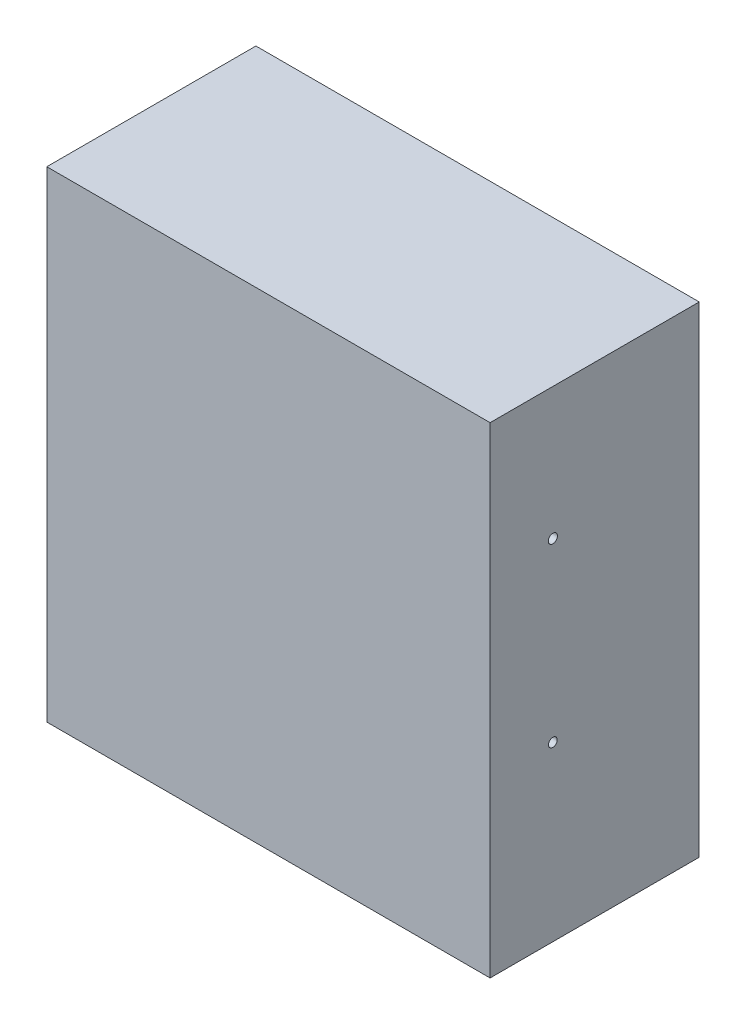
from build123d import *

# Parameters (mm, degrees)
SKETCH_1_W          = 212
SKETCH_1_H          = 230
EXTRUDE_1_DEPTH     = 100
SKETCH_2_W          = 202
SKETCH_2_H          = 90
CUT_EXTRUDE_1_DEPTH = 225
SKETCH_5_R          = 2.2
CUT_EXTRUDE_4_DEPTH = 238
SKETCH_6_R          = 2.1
CUT_EXTRUDE_5_DEPTH = 237


with BuildPart() as part:
    # 草圖1 → 填料-伸長1 (new body)
    with BuildSketch(Plane.XY):
        Rectangle(SKETCH_1_W, SKETCH_1_H)
    extrude(amount=EXTRUDE_1_DEPTH)

    # 草圖2 → 除料-伸長1 (cut)
    with BuildSketch(Plane.XZ.offset(115)):
        with Locations((0, 50)):
            Rectangle(SKETCH_2_W, SKETCH_2_H)
    extrude(amount=-CUT_EXTRUDE_1_DEPTH, mode=Mode.SUBTRACT)

    # 草圖5 → 除料-伸長4 (cut)
    with BuildSketch(Plane(origin=(106, 0, 0), x_dir=(0, 0, -1), z_dir=(1, 0, 0))):
        with Locations((-69.988851691, 52.009212606)):
            Circle(SKETCH_5_R)
    extrude(amount=-CUT_EXTRUDE_4_DEPTH, mode=Mode.SUBTRACT)

    # 草圖6 → 除料-伸長5 (cut)
    with BuildSketch(Plane(origin=(106, 0, 0), x_dir=(0, 0, -1), z_dir=(1, 0, 0))):
        with Locations((-69.988851691, -32.4)):
            Circle(SKETCH_6_R)
    extrude(amount=-CUT_EXTRUDE_5_DEPTH, mode=Mode.SUBTRACT)


solid = part.part
